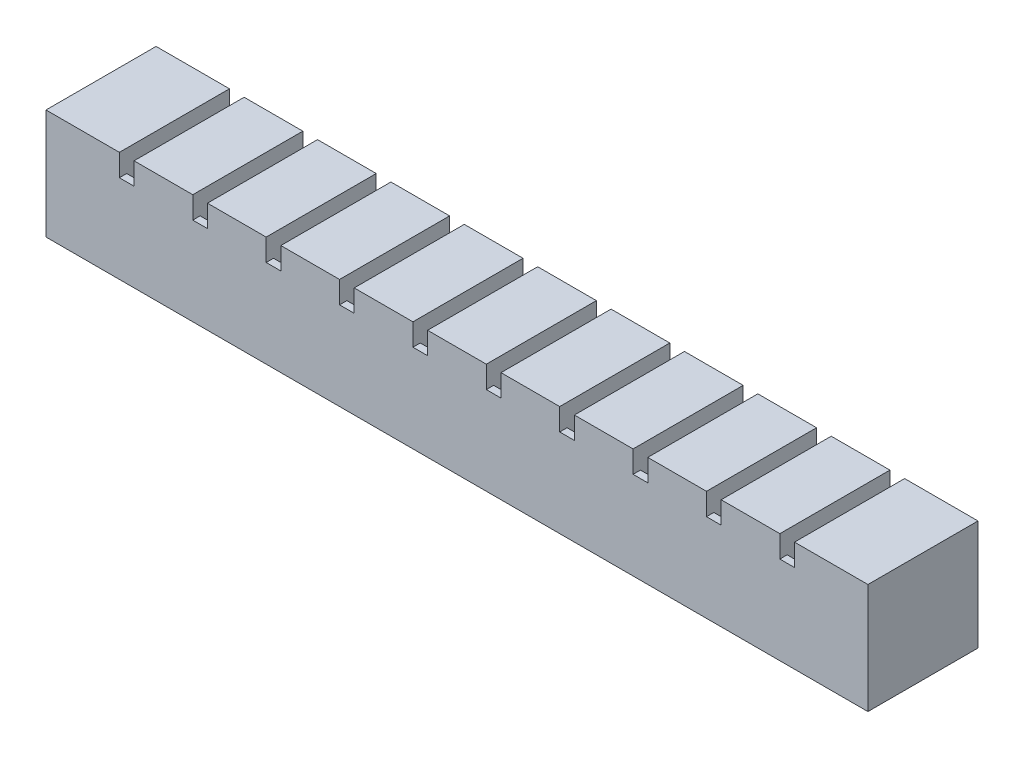
from build123d import *

# Parameters (mm, degrees)
SKETCH1_W                       = 8
SKETCH1_H                       = 15
FIRST_CHAMBER_BLOCK_DEPTH       = 15
SKETCH2_W                       = 6
SKETCH2_H                       = 11
FIRST_CHAMBER_CAVITY_DEPTH      = 13
SKETCH3_W                       = 15
SKETCH3_H                       = 3
CHAMBER_SPACER_DEPTH            = 2
PATTERN_CHAMBERS_COUNT          = 11
PATTERN_CHAMBERS_PITCH          = 10
SKETCH4_W                       = 15
SKETCH4_H                       = 12
THICKEN_END_1_DEPTH             = 2
SKETCH5_W                       = 15
SKETCH5_H                       = 15
THICKEN_END_2_DEPTH             = 2
SKETCH6_W                       = 94
SKETCH6_H                       = 2
CENTRAL_AIR_CHANNEL_DEPTH       = 2
SKETCH7_W                       = 108
SKETCH7_H                       = 13
SKETCH7_W_2                     = 106
SKETCH7_H_2                     = 11
BONDING_RIDGE_DEPTH             = 2
SKETCH9_W                       = 2
SKETCH9_H                       = 2.5
BONDING_BUMPS_DEPTH             = 2
PATTERN_BONDING_BUMPS_COUNT     = 10
PATTERN_BONDING_BUMPS_PITCH     = 10
SKIZZE1_W                       = 112
SKIZZE1_H                       = 15
SCHNITT_LINEAR_AUSTRAGEN1_DEPTH = 113.026782512
SKIZZE2_W                       = 2
SKIZZE2_H                       = 1
AUFSATZ_LINEAR_AUSTRAGEN1_DEPTH = 9
LINEARES_MUSTER1_COUNT          = 10
LINEARES_MUSTER1_PITCH          = 10
SKIZZE3_R                       = 1.25
SCHNITT_LINEAR_AUSTRAGEN2_DEPTH = 112.776562839


with BuildPart() as part:
    # Sketch1 → first chamber block (new body)
    with BuildSketch(Plane.XY):
        with Locations((4, 7.5)):
            Rectangle(SKETCH1_W, SKETCH1_H)
    extrude(amount=FIRST_CHAMBER_BLOCK_DEPTH)

    # Sketch2 → first chamber cavity (cut)
    with BuildSketch(Plane.XZ):
        with Locations((4, 7.5)):
            Rectangle(SKETCH2_W, SKETCH2_H)
    extrude(amount=-FIRST_CHAMBER_CAVITY_DEPTH, mode=Mode.SUBTRACT)

    # Sketch3 → chamber spacer (add)
    with BuildSketch(Plane(origin=(8, 0, 0), x_dir=(0, 0, -1), z_dir=(1, 0, 0))):
        with Locations((-7.5, 1.5)):
            Rectangle(SKETCH3_W, SKETCH3_H)
    extrude(amount=CHAMBER_SPACER_DEPTH)


with BuildPart() as pattern_chambers_1:
    # pattern chambers: pattern copy
    add(part.part.moved(Location(Vector(1, 0, 0) * (1 * PATTERN_CHAMBERS_PITCH))))


with BuildPart() as pattern_chambers_2:
    # pattern chambers: pattern copy
    add(part.part.moved(Location(Vector(1, 0, 0) * (2 * PATTERN_CHAMBERS_PITCH))))


with BuildPart() as pattern_chambers_3:
    # pattern chambers: pattern copy
    add(part.part.moved(Location(Vector(1, 0, 0) * (3 * PATTERN_CHAMBERS_PITCH))))


with BuildPart() as pattern_chambers_4:
    # pattern chambers: pattern copy
    add(part.part.moved(Location(Vector(1, 0, 0) * (4 * PATTERN_CHAMBERS_PITCH))))


with BuildPart() as pattern_chambers_5:
    # pattern chambers: pattern copy
    add(part.part.moved(Location(Vector(1, 0, 0) * (5 * PATTERN_CHAMBERS_PITCH))))


with BuildPart() as pattern_chambers_6:
    # pattern chambers: pattern copy
    add(part.part.moved(Location(Vector(1, 0, 0) * (6 * PATTERN_CHAMBERS_PITCH))))


with BuildPart() as pattern_chambers_7:
    # pattern chambers: pattern copy
    add(part.part.moved(Location(Vector(1, 0, 0) * (7 * PATTERN_CHAMBERS_PITCH))))


with BuildPart() as pattern_chambers_8:
    # pattern chambers: pattern copy
    add(part.part.moved(Location(Vector(1, 0, 0) * (8 * PATTERN_CHAMBERS_PITCH))))


with BuildPart() as pattern_chambers_9:
    # pattern chambers: pattern copy
    add(part.part.moved(Location(Vector(1, 0, 0) * (9 * PATTERN_CHAMBERS_PITCH))))


with BuildPart() as pattern_chambers_10:
    # pattern chambers: pattern copy
    add(part.part.moved(Location(Vector(1, 0, 0) * (10 * PATTERN_CHAMBERS_PITCH))))

    # combine into 1 solid body: union pattern chambers_9, pattern chambers_8, pattern chambers_7, pattern chambers_6, pattern chambers_5, pattern chambers_4, pattern chambers_3, pattern chambers_2, pattern chambers_1, part
    add(pattern_chambers_9.part)
    add(pattern_chambers_8.part)
    add(pattern_chambers_7.part)
    add(pattern_chambers_6.part)
    add(pattern_chambers_5.part)
    add(pattern_chambers_4.part)
    add(pattern_chambers_3.part)
    add(pattern_chambers_2.part)
    add(pattern_chambers_1.part)
    add(part.part)

    # Sketch4 → thicken end 1 (add)
    with BuildSketch(Plane(origin=(108, 0, 0), x_dir=(0, 0, -1), z_dir=(1, 0, 0))):
        with Locations((-7.5, 9)):
            Rectangle(SKETCH4_W, SKETCH4_H)
    extrude(amount=THICKEN_END_1_DEPTH)

    # Sketch5 → thicken end 2 (add)
    with BuildSketch(Plane.ZY):
        with Locations((7.5, 7.5)):
            Rectangle(SKETCH5_W, SKETCH5_H)
    extrude(amount=THICKEN_END_2_DEPTH)

    # Sketch6 → central air channel (cut)
    with BuildSketch(Plane.XZ):
        with Locations((54, 7.5)):
            Rectangle(SKETCH6_W, SKETCH6_H)
    extrude(amount=-CENTRAL_AIR_CHANNEL_DEPTH, mode=Mode.SUBTRACT)

    # Sketch7 → bonding ridge (add)
    with BuildSketch(Plane.XZ):
        with Locations((54, 7.5)):
            Rectangle(SKETCH7_W, SKETCH7_H)
        with Locations((54, 7.5)):
            Rectangle(SKETCH7_W_2, SKETCH7_H_2, mode=Mode.SUBTRACT)
    extrude(amount=BONDING_RIDGE_DEPTH)

    # Sketch9 → bonding bumps (add)
    with BuildSketch(Plane.XZ):
        with Locations((9, 10.75)):
            Rectangle(SKETCH9_W, SKETCH9_H)
        with Locations((9, 4.25)):
            Rectangle(SKETCH9_W, SKETCH9_H)
    bonding_bumps = extrude(amount=BONDING_BUMPS_DEPTH)

    # pattern bonding bumps: bonding bumps ×10
    with Locations(*[(i * PATTERN_BONDING_BUMPS_PITCH, 0, 0) for i in range(1, PATTERN_BONDING_BUMPS_COUNT)]):
        add(bonding_bumps)

    # Skizze1 → Schnitt-Linear austragen1 (cut, through all)
    with BuildSketch(Plane.XZ):
        with Locations((54, 7.5)):
            Rectangle(SKIZZE1_W, SKIZZE1_H)
    extrude(amount=SCHNITT_LINEAR_AUSTRAGEN1_DEPTH, mode=Mode.SUBTRACT)

    # Skizze2 → Aufsatz-Linear austragen1 (add)
    with BuildSketch(Plane(origin=(0, 3, 0), x_dir=(1, 0, 0), z_dir=(0, 1, 0))):
        with Locations((99, -0.5)):
            Rectangle(SKIZZE2_W, SKIZZE2_H)
        with Locations((99, -14.5)):
            Rectangle(SKIZZE2_W, SKIZZE2_H)
    aufsatz_linear_austragen1 = extrude(amount=AUFSATZ_LINEAR_AUSTRAGEN1_DEPTH)

    # Lineares Muster1: Aufsatz-Linear austragen1 ×10
    with Locations(*[(-i * LINEARES_MUSTER1_PITCH, 0, 0) for i in range(1, LINEARES_MUSTER1_COUNT)]):
        add(aufsatz_linear_austragen1)

    # Skizze3 → Schnitt-Linear austragen2 (cut, through all)
    with BuildSketch(Plane.XY.offset(2)):
        with Locations((104, 6.5)):
            Circle(SKIZZE3_R)
    extrude(amount=-SCHNITT_LINEAR_AUSTRAGEN2_DEPTH, mode=Mode.SUBTRACT)


solid = pattern_chambers_10.part
